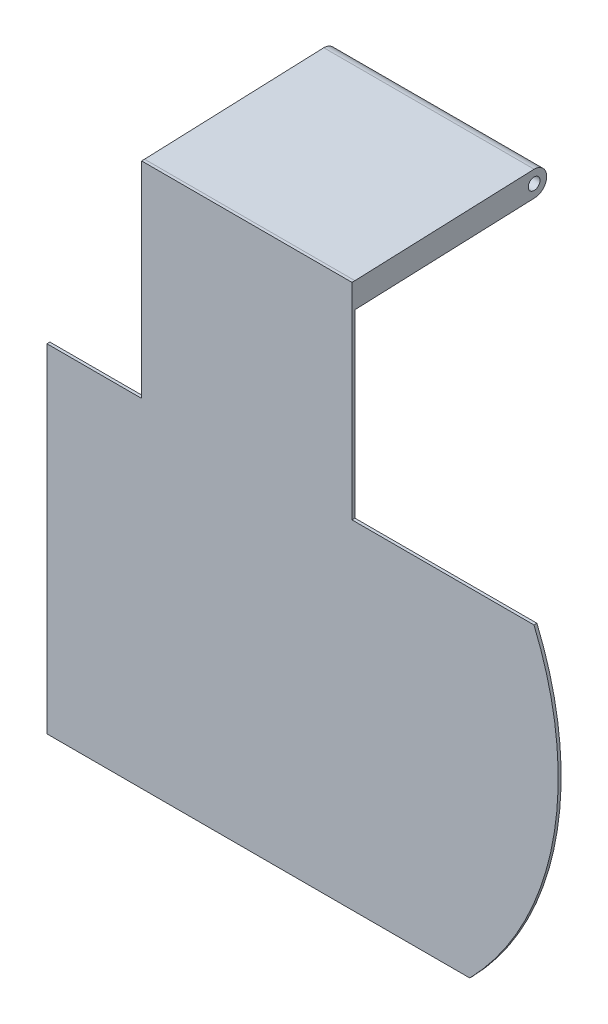
from build123d import *

# Parameters (mm, degrees)
ESTRUSIONE_ESTRUSIONE1_DEPTH = 1
SCHIZZO2_W                   = 71.6
SCHIZZO2_H                   = 70
ESTRUSIONE_ESTRUSIONE2_DEPTH = 1
SCHIZZO3_R                   = 2
ESTRUSIONE_ESTRUSIONE3_DEPTH = 71.6


with BuildPart() as part:
    # Schizzo1 → Estrusione-Estrusione1 (new body)
    with BuildSketch(Plane(origin=(0, 0, 0), x_dir=(-1, 0, 0), z_dir=(0, 0, 1))):
        with BuildLine():
            Line((68, -41), (68, 74))
            Line((68, 74), (-75.894663844, 74))
            ThreePointArc((-75.894663844, 74), (-104.136158772, 19.790412733), (-97.749680306, -41))
            Line((-97.749680306, -41), (68, -41))
        make_face()
    extrude(amount=ESTRUSIONE_ESTRUSIONE1_DEPTH)

    # Schizzo2 → Estrusione-Estrusione2 (add)
    with BuildSketch(Plane(origin=(0, 0, 0), x_dir=(-1, 0, 0), z_dir=(0, 0, -1))):
        with Locations((-0.004840153, 76)):
            Rectangle(SCHIZZO2_W, SCHIZZO2_H)
    extrude(amount=-ESTRUSIONE_ESTRUSIONE2_DEPTH)

    # Schizzo3 → Estrusione-Estrusione3 (add)
    with BuildSketch(Plane.ZY.offset(35.795159847)):
        with BuildLine():
            Line((-61, 113.35913787), (0, 111))
            Line((0, 111), (0, 102.42172426))
            Line((0, 102.42172426), (-61, 104.78086213))
            ThreePointArc((-61, 104.78086213), (-65.28913787, 109.07), (-61, 113.35913787))
        make_face()
        with Locations((-61, 109.07)):
            Circle(SCHIZZO3_R, mode=Mode.SUBTRACT)
    extrude(amount=-ESTRUSIONE_ESTRUSIONE3_DEPTH)


solid = part.part
